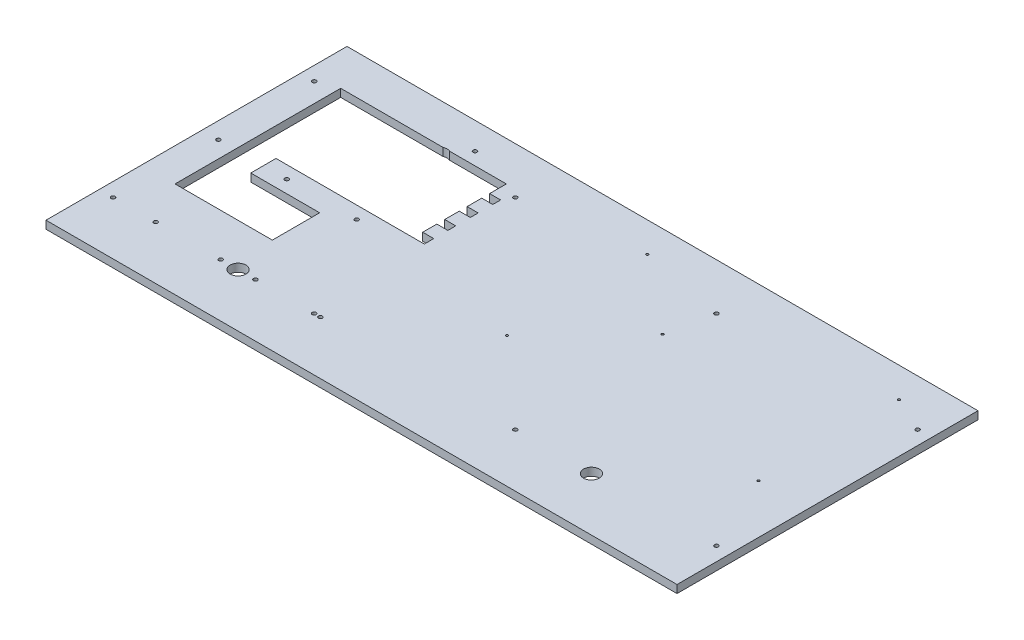
from build123d import *

# Parameters (mm, degrees)
SKETCH2_W           = 400
SKETCH2_H           = 190.8
BOSS_EXTRUDE1_DEPTH = 5
SKETCH3_R           = 5
CUT_EXTRUDE1_DEPTH  = 223.556172685
SKETCH4_R           = 1.25
CUT_EXTRUDE2_DEPTH  = 223.556172685
CUT_EXTRUDE3_DEPTH  = 223.556172685
SKETCH7_R           = 0.75
CUT_EXTRUDE4_DEPTH  = 223.556172685
SKETCH8_R           = 1.25
CUT_EXTRUDE5_DEPTH  = 10
SKETCH9_R           = 1.25
CUT_EXTRUDE6_DEPTH  = 223.556172685


with BuildPart() as part:
    # Sketch2 → Boss-Extrude1 (new body)
    with BuildSketch(Plane(origin=(0, 0, 0), x_dir=(1, 0, 0), z_dir=(0, 1, 0))):
        with Locations((0, -2.1)):
            Rectangle(SKETCH2_W, SKETCH2_H)
    extrude(amount=BOSS_EXTRUDE1_DEPTH)

    # Sketch3 → Cut-Extrude1 (cut, through all)
    with BuildSketch(Plane(origin=(0, 5, 0), x_dir=(1, 0, 0), z_dir=(0, 1, 0))):
        with Locations(Location((-112, 63.75, 0), (0, 0, 270))):
            Circle(SKETCH3_R)
        with Locations(Location((112, -63.75, 0), (0, 0, 270))):
            Circle(SKETCH3_R)
        with Locations(Location((-112, -63.75, 0), (0, 0, 270))):
            Circle(SKETCH3_R)
    extrude(amount=-CUT_EXTRUDE1_DEPTH, mode=Mode.SUBTRACT)

    # Sketch4 → Cut-Extrude2 (cut, through all)
    with BuildSketch(Plane(origin=(0, 5, 0), x_dir=(1, 0, 0), z_dir=(0, 1, 0))):
        with Locations(Location((-191.25, 63.75, 0), (0, 0, 270))):
            Circle(SKETCH4_R)
        with Locations(Location((-63.75, 63.75, 0), (0, 0, 270))):
            Circle(SKETCH4_R)
        with Locations(Location((63.75, 63.75, 0), (0, 0, 270))):
            Circle(SKETCH4_R)
        with Locations(Location((191.25, 63.75, 0), (0, 0, 270))):
            Circle(SKETCH4_R)
        with Locations(Location((191.25, -63.75, 0), (0, 0, 270))):
            Circle(SKETCH4_R)
        with Locations(Location((63.75, -63.75, 0), (0, 0, 270))):
            Circle(SKETCH4_R)
        with Locations(Location((-63.75, -63.75, 0), (0, 0, 270))):
            Circle(SKETCH4_R)
        with Locations(Location((-191.25, -63.75, 0), (0, 0, 270))):
            Circle(SKETCH4_R)
    extrude(amount=-CUT_EXTRUDE2_DEPTH, mode=Mode.SUBTRACT)

    # Sketch5 → Cut-Extrude3 (cut, through all)
    with BuildSketch(Plane(origin=(0, 5, 0), x_dir=(1, 0, 0), z_dir=(0, 1, 0))):
        Polygon((-179, 68.3), (-179, -36.7), (-117.327189105, -36.7), (-117.327189105, -6.7), (-161, -6.7), (-161, 9.3), (-67, 9.3), (-67, 15.3), (-74, 15.3), (-74, 24.252605128), (-67, 24.252605128), (-67, 29.252605128), (-74, 29.252605128), (-74, 38.451162805), (-67, 38.451162805), (-67, 43.451162805), (-74, 43.451162805), (-74, 52.70528249), (-67, 52.70528249), (-67, 57.70528249), (-74, 57.70528249), (-74, 68.3), (-76.383096774, 68.3), align=None)
    extrude(amount=-CUT_EXTRUDE3_DEPTH, mode=Mode.SUBTRACT)

    # Sketch7 → Cut-Extrude4 (cut, through all)
    with BuildSketch(Plane(origin=(0, 5, 0), x_dir=(1, 0, 0), z_dir=(0, 1, 0))):
        with Locations(Location((9.399984, 74.29999922, 0), (0, 0, 270))):
            Circle(SKETCH7_R)
        with Locations(Location((58.062496917, 35.300001471, 0), (0, 0, 270))):
            Circle(SKETCH7_R)
        with Locations(Location((168.9, 74.29999922, 0), (0, 0, 270))):
            Circle(SKETCH7_R)
        with Locations(Location((168.9, -14.70000278, 0), (0, 0, 270))):
            Circle(SKETCH7_R)
        with Locations(Location((9.399984, -14.70000278, 0), (0, 0, 270))):
            Circle(SKETCH7_R)
    extrude(amount=-CUT_EXTRUDE4_DEPTH, mode=Mode.SUBTRACT)

    # Sketch8 → Cut-Extrude5 (cut)
    with BuildSketch(Plane(origin=(0, 5, 0), x_dir=(1, 0, 0), z_dir=(0, 1, 0))):
        with Locations(Location((-164.2, -63.75, 0), (0, 0, 270))):
            Circle(SKETCH8_R)
        with Locations(Location((-123, -63.75, 0), (0, 0, 270))):
            Circle(SKETCH8_R)
        with Locations(Location((-101, -63.75, 0), (0, 0, 270))):
            Circle(SKETCH8_R)
        with Locations(Location((-59.8, -63.75, 0), (0, 0, 270))):
            Circle(SKETCH8_R)
    extrude(amount=-CUT_EXTRUDE5_DEPTH, mode=Mode.SUBTRACT)

    # Sketch9 → Cut-Extrude6 (cut, through all)
    with BuildSketch(Plane(origin=(0, 5, 0), x_dir=(1, 0, 0), z_dir=(0, 1, 0))):
        with Locations(Location((-189.5, 1.3, 0), (0, 0, 270))):
            Circle(SKETCH9_R)
        with Locations(Location((-146.206430225, 1.3, 0), (0, 0, 270))):
            Circle(SKETCH9_R)
        with Locations(Location((-101.86, 76.3, 0), (0, 0, 270))):
            Circle(SKETCH9_R)
        with Locations(Location((-101.86, 1.3, 0), (0, 0, 270))):
            Circle(SKETCH9_R)
    extrude(amount=-CUT_EXTRUDE6_DEPTH, mode=Mode.SUBTRACT)


solid = part.part
